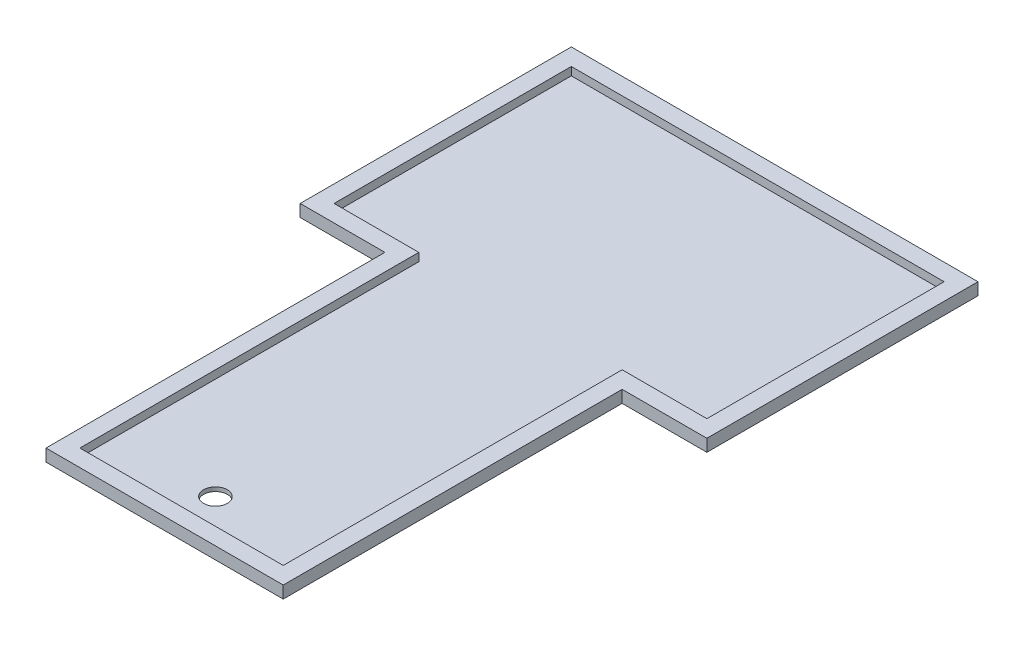
from build123d import *

# Parameters (mm, degrees)
SKETCH1_R           = 3.5
BOSS_EXTRUDE1_DEPTH = 1.2
BOSS_EXTRUDE2_DEPTH = 2.4


with BuildPart() as part:
    # Sketch1 → Boss-Extrude1 (new body)
    with BuildSketch(Plane(origin=(0, 0, 0), x_dir=(1, 0, 0), z_dir=(0, 1, 0))):
        Polygon((-60, -40), (-35, -40), (-35, -140), (35, -140), (35, -40), (60, -40), (60, 40), (-60, 40), align=None)
        with Locations(Location((0, -125, 0), (0, 0, 270))):
            Circle(SKETCH1_R, mode=Mode.SUBTRACT)
    extrude(amount=BOSS_EXTRUDE1_DEPTH)

    # Sketch2 → Boss-Extrude2 (add)
    with BuildSketch(Plane(origin=(0, 1.2, 0), x_dir=(1, 0, 0), z_dir=(0, 1, 0))):
        Polygon((-60, -40), (-35, -40), (-35, -140), (35, -140), (35, -40), (60, -40), (60, 0), (60, 40), (-60, 40), (-60, 0), align=None)
        Polygon((-55, -35), (-30, -35), (-30, -135), (30, -135), (30, -35), (55, -35), (55, 0), (55, 35), (-55, 35), (-55, 0), align=None, mode=Mode.SUBTRACT)
    extrude(amount=BOSS_EXTRUDE2_DEPTH)


solid = part.part
